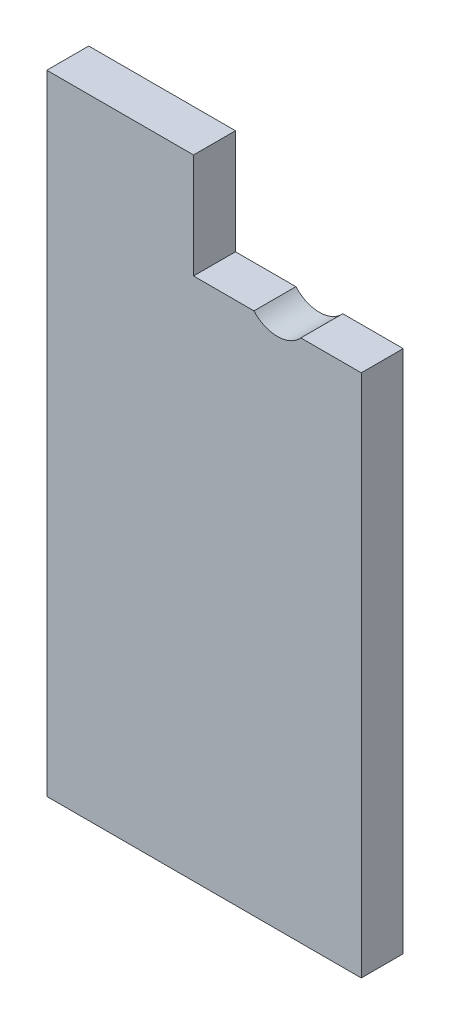
from build123d import *

# Parameters (mm, degrees)
BOSS_EXTRUDE1_DEPTH = 2


with BuildPart() as part:
    # Sketch1 → Boss-Extrude1 (new body)
    with BuildSketch(Plane.XY):
        with BuildLine():
            Line((15, 25), (12.118033989, 25))
            ThreePointArc((12.118033989, 25), (11, 24.5), (9.881966011, 25))
            Line((9.881966011, 25), (7, 25))
            Line((7, 25), (7, 30))
            Line((7, 30), (0, 30))
            Line((0, 30), (0, 0))
            Line((0, 0), (15, 0))
            Line((15, 0), (15, 25))
        make_face()
    extrude(amount=BOSS_EXTRUDE1_DEPTH)


solid = part.part
